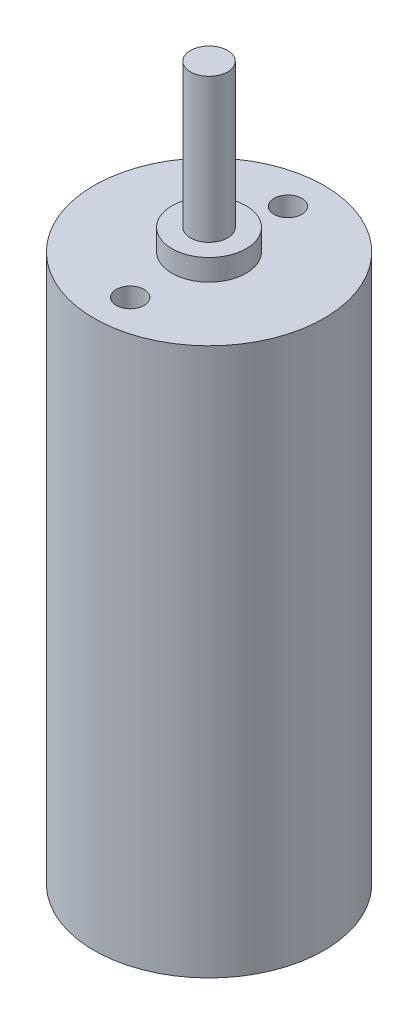
from build123d import *

# Parameters (mm, degrees)
SKETCH1_R           = 12.4
BOSS_EXTRUDE1_DEPTH = 59
SKETCH2_R           = 1.5
CUT_EXTRUDE1_DEPTH  = 3.4798
SKETCH4_R           = 4
BOSS_EXTRUDE3_DEPTH = 2.3
SKETCH5_R           = 2
BOSS_EXTRUDE4_DEPTH = 15.5


with BuildPart() as part:
    # Sketch1 → Boss-Extrude1 (new body)
    with BuildSketch(Plane(origin=(0, 0, 0), x_dir=(1, 0, 0), z_dir=(0, 1, 0))):
        with Locations(Location((0, 0, 0), (0, 0, 90))):
            Circle(SKETCH1_R)
    extrude(amount=BOSS_EXTRUDE1_DEPTH)

    # Sketch2 → Cut-Extrude1 (cut)
    with BuildSketch(Plane(origin=(0, 59, 0), x_dir=(1, 0, 0), z_dir=(0, 1, 0))):
        with Locations(Location((0, 8.5, 0), (0, 0, 270))):
            Circle(SKETCH2_R)
        with Locations(Location((0, -8.5, 0), (0, 0, 270))):
            Circle(SKETCH2_R)
    extrude(amount=-CUT_EXTRUDE1_DEPTH, mode=Mode.SUBTRACT)

    # Sketch4 → Boss-Extrude3 (add)
    with BuildSketch(Plane(origin=(0, 59, 0), x_dir=(1, 0, 0), z_dir=(0, 1, 0))):
        with Locations(Location((0, 0, 0), (0, 0, 270))):
            Circle(SKETCH4_R)
    extrude(amount=BOSS_EXTRUDE3_DEPTH)

    # Sketch5 → Boss-Extrude4 (add)
    with BuildSketch(Plane(origin=(0, 61.3, 0), x_dir=(1, 0, 0), z_dir=(0, 1, 0))):
        with Locations(Location((0, 0, 0), (0, 0, 270))):
            Circle(SKETCH5_R)
    extrude(amount=BOSS_EXTRUDE4_DEPTH)


solid = part.part
